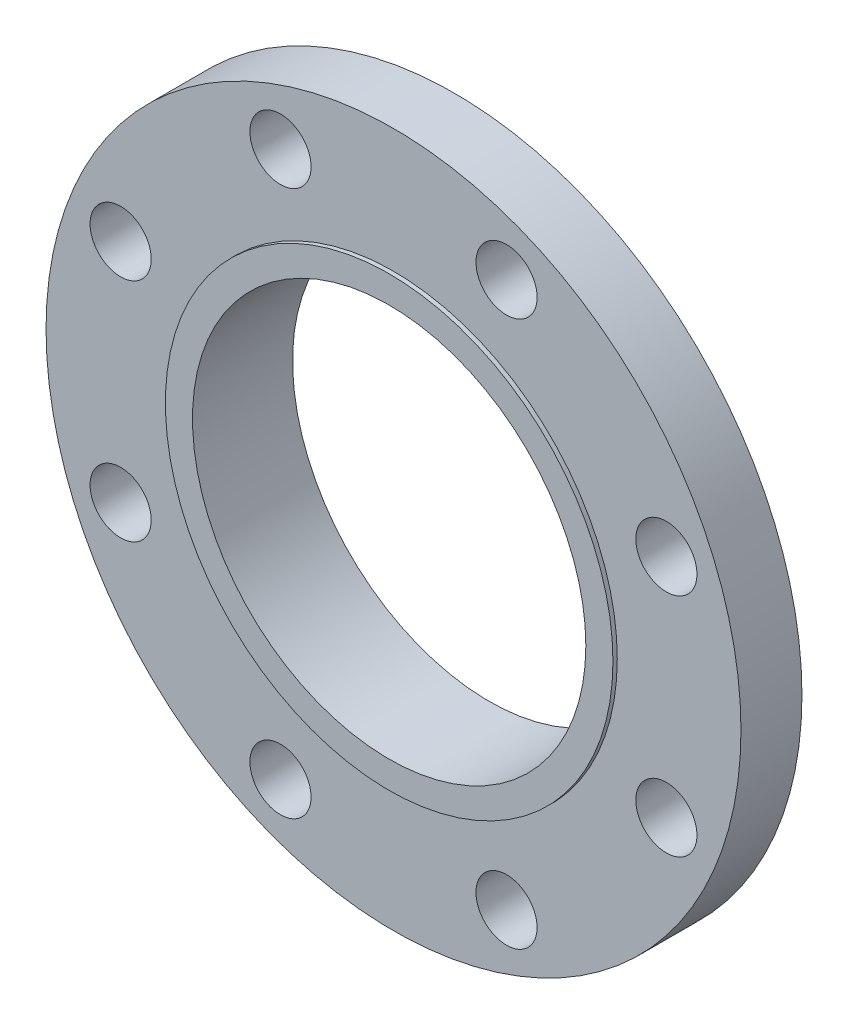
from build123d import *

# Parameters (mm, degrees)
HUB_DIAMETER_R                = 81.788
HUB_DEPTH                     = 36.576
FLANGE_DIAMETER_R             = 127
FLANGE_DEPTH                  = 22.2885
REVOLUTION_PROFILE_FOR_BORE_W = 71.882
REVOLUTION_PROFILE_FOR_BORE_H = 228.6
BOLT_DIAMETER_R               = 11.176
BOLT_HOLE_DEPTH               = 183.981406521
BOLT_HOLE_PATTERN_COUNT       = 8
BOLT_HOLE_PATTERN_ANGLE       = 315


with BuildPart() as part:
    # Hub Diameter → Hub (new body)
    with BuildSketch(Plane.XY):
        Circle(HUB_DIAMETER_R)
    extrude(amount=-HUB_DEPTH)

    # Flange Diameter → Flange (add)
    with BuildSketch(Plane.XY.offset(-1.5875)):
        Circle(FLANGE_DIAMETER_R)
    extrude(amount=-FLANGE_DEPTH)

    # Revolution profile for Bore → Bore (revolve, cut)
    with BuildSketch(Plane(origin=(0, 0, 0), x_dir=(1, 0, 0), z_dir=(0, 1, 0))):
        with Locations((35.941, 114.3)):
            Rectangle(REVOLUTION_PROFILE_FOR_BORE_W, REVOLUTION_PROFILE_FOR_BORE_H)
    revolve(axis=Axis((0, 0, 19.52131148), (0, 0, -1)), mode=Mode.SUBTRACT)

    # Bolt Diameter → Bolt Hole (cut, through all)
    with BuildSketch(Plane.XY.offset(-1.5875)):
        with Locations((41.310676524, 99.732795535)):
            Circle(BOLT_DIAMETER_R)
    bolt_hole = extrude(amount=-BOLT_HOLE_DEPTH, mode=Mode.SUBTRACT)

    # Bolt Hole Pattern: Bolt Hole ×8 about axis
    bolt_hole_pattern_axis = Axis((0, 0, -50), (0, 0, 1))
    for i in range(1, BOLT_HOLE_PATTERN_COUNT):
        add(bolt_hole.rotate(bolt_hole_pattern_axis, i * BOLT_HOLE_PATTERN_ANGLE / (BOLT_HOLE_PATTERN_COUNT - 1)), mode=Mode.SUBTRACT)


solid = part.part
